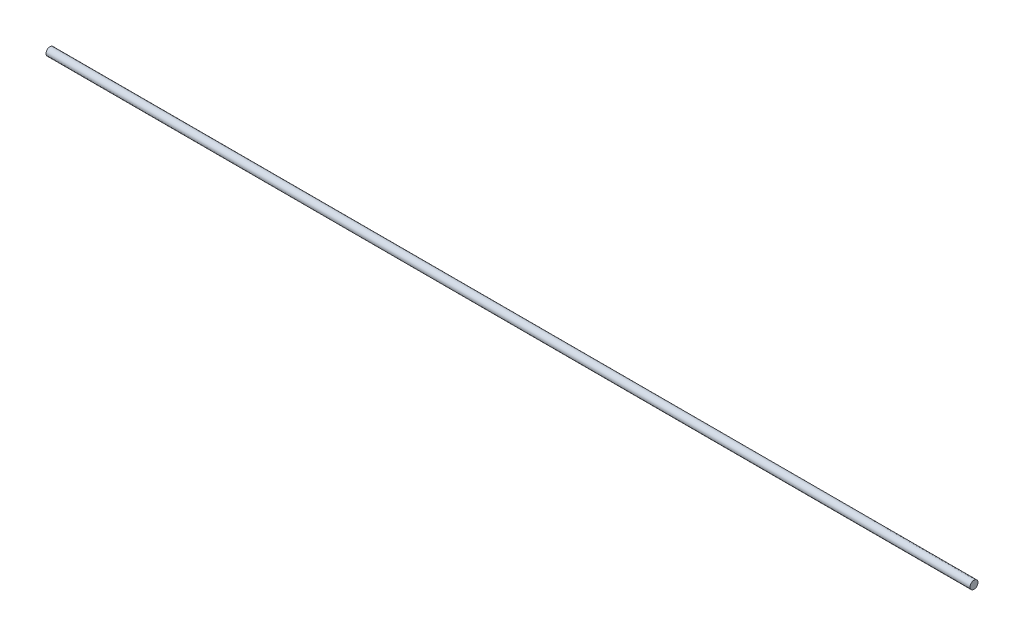
from build123d import *

# Parameters (mm, degrees)
SKETCH1_R           = 3.5
BOSS_EXTRUDE1_DEPTH = 812.8


with BuildPart() as part:
    # Sketch1 → Boss-Extrude1 (new body)
    with BuildSketch(Plane(origin=(0, 0, 0), x_dir=(0, 0, -1), z_dir=(1, 0, 0))):
        Circle(SKETCH1_R)
    extrude(amount=BOSS_EXTRUDE1_DEPTH)


solid = part.part
